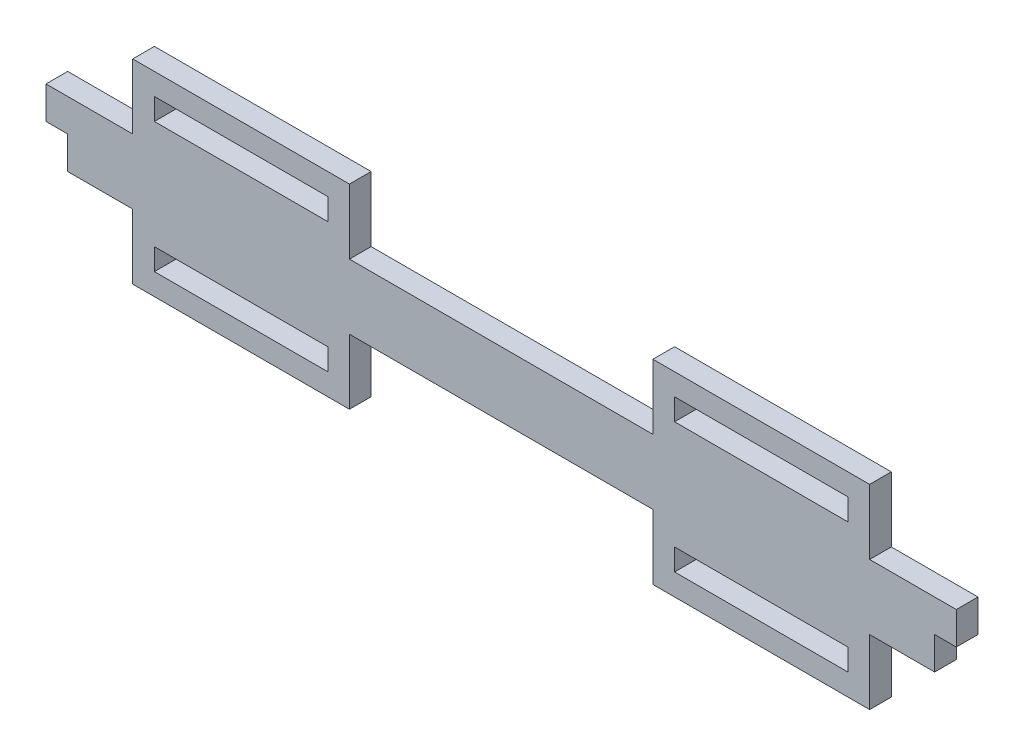
from build123d import *

# Parameters (mm, degrees)
SKETCH1_W           = 210
SKETCH1_H           = 15
BOSS_EXTRUDE1_DEPTH = 5
SKETCH2_W           = 50
SKETCH2_H           = 5
BOSS_EXTRUDE2_DEPTH = 5
SKETCH3_W           = 5
SKETCH3_H           = 7.5
CUT_EXTRUDE1_DEPTH  = 5
BOSS_EXTRUDE3_DEPTH = 5


with BuildPart() as part:
    # Sketch1 → Boss-Extrude1 (new body)
    with BuildSketch(Plane.XY):
        with Locations((-105, 7.5)):
            Rectangle(SKETCH1_W, SKETCH1_H)
    extrude(amount=BOSS_EXTRUDE1_DEPTH)

    # Sketch2 → Boss-Extrude2 (add)
    with BuildSketch(Plane(origin=(0, 0, 0), x_dir=(-1, 0, 0), z_dir=(0, 0, -1))):
        with Locations((45, -2.5)):
            Rectangle(SKETCH2_W, SKETCH2_H)
        with Locations((165, -2.5)):
            Rectangle(SKETCH2_W, SKETCH2_H)
        with Locations((165, 17.5)):
            Rectangle(SKETCH2_W, SKETCH2_H)
        with Locations((45, 17.5)):
            Rectangle(SKETCH2_W, SKETCH2_H)
    extrude(amount=-BOSS_EXTRUDE2_DEPTH)

    # Sketch3 → Cut-Extrude1 (cut)
    with BuildSketch(Plane(origin=(0, 0, 0), x_dir=(-1, 0, 0), z_dir=(0, 0, -1))):
        with Locations((2.5, 3.75)):
            Rectangle(SKETCH3_W, SKETCH3_H)
        with Locations((207.5, 3.75)):
            Rectangle(SKETCH3_W, SKETCH3_H)
    extrude(amount=-CUT_EXTRUDE1_DEPTH, mode=Mode.SUBTRACT)

    # Sketch4 → Boss-Extrude3 (add)
    with BuildSketch(Plane(origin=(0, 0, 0), x_dir=(-1, 0, 0), z_dir=(0, 0, -1))):
        Polygon((140, 30), (140, 20), (145, 20), (145, 25), (185, 25), (185, 20), (190, 20), (190, 30), align=None)
        Polygon((20, 20), (25, 20), (25, 25), (65, 25), (65, 20), (70, 20), (70, 30), (20, 30), align=None)
        Polygon((70, -15), (70, -5), (65, -5), (65, -10), (25, -10), (25, -5), (20, -5), (20, -15), align=None)
        Polygon((190, -5), (185, -5), (185, -10), (145, -10), (145, -5), (140, -5), (140, -15), (190, -15), align=None)
    extrude(amount=-BOSS_EXTRUDE3_DEPTH)


solid = part.part
